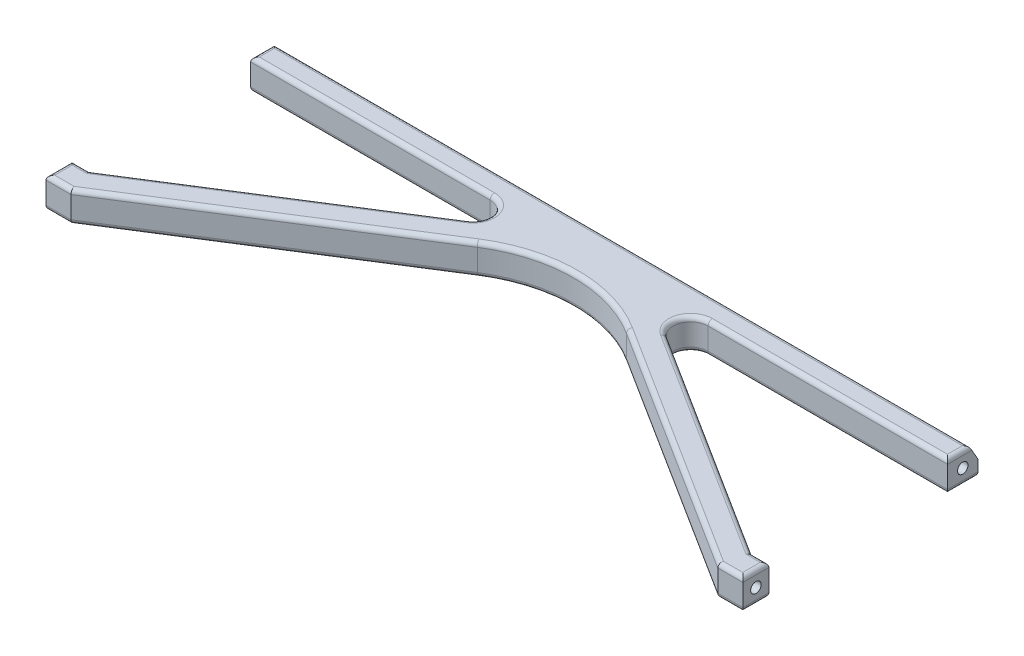
from build123d import *

# Parameters (mm, degrees)
BOSS_EXTRUDE1_DEPTH = 11.1125
CHAMFER1_SIZE       = 3.175
CHAMFER1_SIZE2      = 5.499261314
FILLET1_R           = 50.8
FILLET2_R           = 6.35
SKETCH2_R           = 1.905
CUT_EXTRUDE1_DEPTH  = 12.7
FILLET4_R           = 1.5875


with BuildPart() as part:
    # Sketch1 → Boss-Extrude1 (new body)
    with BuildSketch(Plane(origin=(0, 0, 0), x_dir=(1, 0, 0), z_dir=(0, 1, 0))):
        Polygon((-127, 0), (127, 0), (127, -11.1125), (17.810616698, -11.1125), (120.65, -76.2), (127, -76.2), (127, -85.725), (117.889049151, -85.725), (0, -11.1125), (-117.889049151, -85.725), (-127, -85.725), (-127, -76.2), (-120.65, -76.2), (-17.810616698, -11.1125), (-55.527449944, -11.1125), (-127, -11.1125), align=None)
    extrude(amount=BOSS_EXTRUDE1_DEPTH)

    # Chamfer1
    chamfer1_edges = [part.edges().sort_by_distance(p)[0] for p in [
        (0, 11.1125, 0),
    ]]
    chamfer1_side = [part.faces().sort_by_distance(p)[0] for p in [
        (0, 11.1125, 2.680760631),
    ]]
    chamfer(chamfer1_edges, length=CHAMFER1_SIZE, length2=CHAMFER1_SIZE2, reference=chamfer1_side[0])

    # Fillet1
    fillet1_edges = [part.edges().sort_by_distance(p)[0] for p in [
        (0, 5.55625, 11.1125),
    ]]
    fillet(fillet1_edges, radius=FILLET1_R)

    # Fillet2
    fillet2_edges = [part.edges().sort_by_distance(p)[0] for p in [
        (-17.810616698, 5.55625, 11.1125),
        (17.810616698, 5.55625, 11.1125),
    ]]
    fillet(fillet2_edges, radius=FILLET2_R)

    # Sketch2 → Cut-Extrude1 (cut)
    with BuildSketch(Plane.ZY.offset(127)):
        with Locations((5.55625, 5.55625)):
            Circle(SKETCH2_R)
        with Locations((80.9625, 5.55625)):
            Circle(SKETCH2_R)
    cut_extrude1 = extrude(amount=-CUT_EXTRUDE1_DEPTH, mode=Mode.SUBTRACT)

    # Mirror1: Cut-Extrude1 across plane
    add(cut_extrude1.mirror(Plane(origin=(0, 0, 0), x_dir=(0, 0, 1), z_dir=(1, 0, 0))), mode=Mode.SUBTRACT)

    # Fillet4
    fillet4_edges = [part.edges().sort_by_distance(p)[0] for p in [
        (-127, 11.1125, 80.9625),
        (-83.358735865, 0, 11.1125),
        (-127, 0, 5.55625),
        (-122.444524575, 11.1125, 85.725),
        (0, 0, 0),
        (127, 0, 5.55625),
        (78.485766866, 0, 49.514070583),
        (123.825, 0, 76.2),
        (127, 0, 80.9625),
        (122.444524575, 0, 85.725),
        (-72.528276565, 0, 57.015966642),
        (-122.444524575, 0, 85.725),
        (-72.528276565, 11.1125, 57.015966642),
        (-127, 0, 80.9625),
        (-123.825, 0, 76.2),
        (122.444524575, 11.1125, 85.725),
        (127, 11.1125, 80.9625),
        (123.825, 11.1125, 76.2),
        (78.485766866, 11.1125, 49.514070583),
        (-127, 11.1125, 7.14375),
        (0, 11.1125, 3.175),
        (127, 11.1125, 7.14375),
        (0, 5.613238686, 0),
        (72.528276565, 0, 57.015966642),
        (72.528276565, 11.1125, 57.015966642),
        (0, 0, 20.43206261),
        (0, 11.1125, 20.43206261),
        (-83.358735865, 11.1125, 11.1125),
        (83.358735865, 0, 11.1125),
        (83.358735865, 11.1125, 11.1125),
        (-78.485766866, 0, 49.514070583),
        (-78.485766866, 11.1125, 49.514070583),
        (33.618524222, 0, 15.694637081),
        (33.618524222, 11.1125, 15.694637081),
        (-33.618524222, 0, 15.694637081),
        (-33.618524222, 11.1125, 15.694637081),
        (-123.825, 11.1125, 76.2),
    ]]
    fillet(fillet4_edges, radius=FILLET4_R)


solid = part.part
